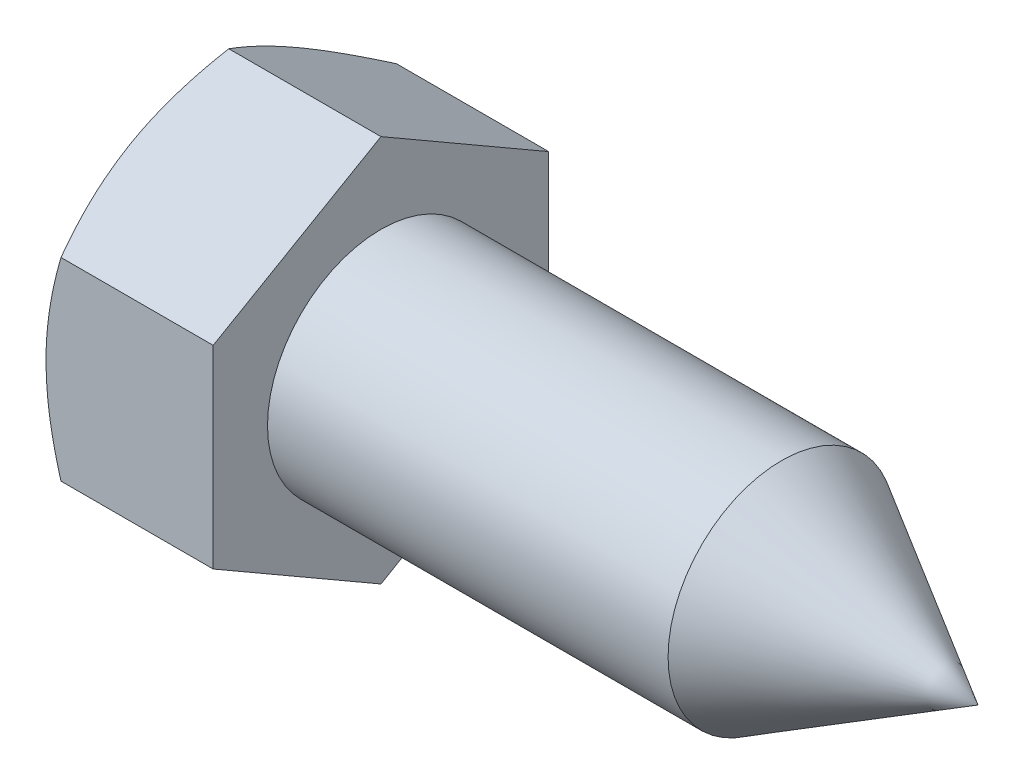
from build123d import *

# Parameters (mm, degrees)
BASEHEAD_DEPTH = 3.556


with BuildPart() as part:
    # Sketch1 → BaseHead (new body)
    with BuildSketch(Plane(origin=(0, 0, 0), x_dir=(0, 0, -1), z_dir=(1, 0, 0))):
        Polygon((3.5687, 2.060389906), (3.5687, -2.060389906), (0, -4.120779811), (-3.5687, -2.060389906), (-3.5687, 2.060389906), (0, 4.120779811), align=None)
    extrude(amount=BASEHEAD_DEPTH)

    # Sketch2 → BaseBody (revolve)
    with BuildSketch(Plane.XY, mode=Mode.PRIVATE) as basebody_sk:
        Polygon((0, 0), (16.256, 0), (12.076561401, 2.413), (0, 2.413), align=None)
    revolve(basebody_sk.sketch.rotate(Axis((0, 0, 0), (1, 0, 0)), 90), axis=Axis((0, 0, 0), (1, 0, 0)))

    # Sketch3 → HeadChamfer (revolve, cut)
    with BuildSketch(Plane.XY):
        Polygon((0, 3.5687), (3.984917637, 10.470779811), (3.984917637, 16.820779811), (-12.7, 16.820779811), (-12.7, 3.5687), align=None)
    revolve(axis=Axis((0, 0, 0), (1, 0, 0)), mode=Mode.SUBTRACT)


solid = part.part
